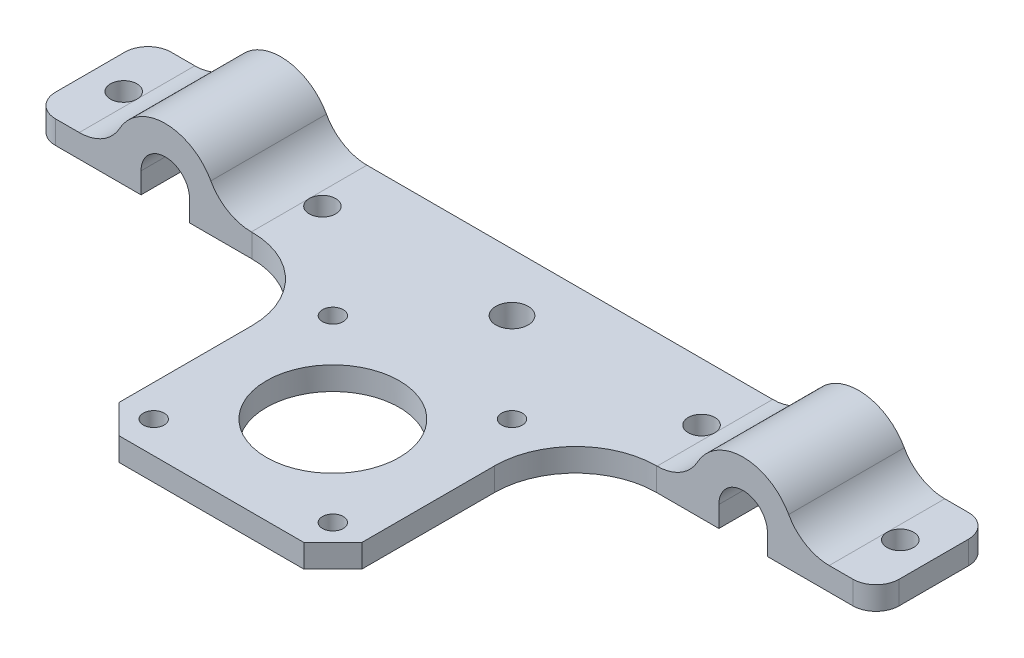
from build123d import *

# Parameters (mm, degrees)
EXTRUDE_1_DEPTH          = 20
FILLET_1_R               = 4
SKETCH_3_W               = 42
SKETCH_3_H               = 4
EXTRUDE_2_DEPTH          = 42
FILLET_2_R               = 14
CHAMFER_1_SIZE           = 5
CUT_EXTRUDE_1_DEPTH      = 97.177520869
CUT_EXTRUDE_1_DEPTH_BACK = 97.177520869
SKETCH_2_R               = 2.8
SKETCH_2_R_2             = 2.3
SKETCH_2_R_3             = 11.5
SKETCH_2_R_4             = 1.8


with BuildPart() as part:
    # 草图1 → 凸台-拉伸1 (new body)
    with BuildSketch(Plane.XY):
        with BuildLine():
            Line((54.2, 3.8), (54.2, 0.2))
            Line((54.2, 0.2), (72.997777503, 0.2))
            Line((72.997777503, 0.2), (72.997777503, 4.2))
            Line((72.997777503, 4.2), (64.891608375, 4.2))
            ThreePointArc((64.891608375, 4.2), (60.821632223, 5.312671482), (57.883792669, 8.341176471))
            ThreePointArc((57.883792669, 8.341176471), (50, 13), (42.116207331, 8.341176471))
            ThreePointArc((42.116207331, 8.341176471), (39.178367777, 5.312671482), (35.108391625, 4.2))
            Line((35.108391625, 4.2), (-35.108391625, 4.2))
            ThreePointArc((-35.108391625, 4.2), (-39.178367777, 5.312671482), (-42.116207331, 8.341176471))
            ThreePointArc((-42.116207331, 8.341176471), (-50, 13), (-57.883792669, 8.341176471))
            ThreePointArc((-57.883792669, 8.341176471), (-60.821632223, 5.312671482), (-64.891608375, 4.2))
            Line((-64.891608375, 4.2), (-72.997777503, 4.2))
            Line((-72.997777503, 4.2), (-72.997777503, 0.2))
            Line((-72.997777503, 0.2), (-54.2, 0.2))
            Line((-54.2, 0.2), (-54.2, 3.8))
            ThreePointArc((-54.2, 3.8), (-50, 8), (-45.8, 3.8))
            Line((-45.8, 3.8), (-45.8, 0.2))
            Line((-45.8, 0.2), (45.8, 0.2))
            Line((45.8, 0.2), (45.8, 3.8))
            ThreePointArc((45.8, 3.8), (50, 8), (54.2, 3.8))
        make_face()
    extrude(amount=EXTRUDE_1_DEPTH)

    # 圆角1
    fillet_1_edges = [part.edges().sort_by_distance(p)[0] for p in [
        (72.997777503, 2.2, 20),
        (-72.997777503, 2.2, 0),
        (72.997777503, 2.2, 0),
        (-72.997777503, 2.2, 20),
    ]]
    fillet(fillet_1_edges, radius=FILLET_1_R)

    # 草图3 → 凸台-拉伸2 (add)
    with BuildSketch(Plane.XY.offset(20)):
        with Locations((0, 2.2)):
            Rectangle(SKETCH_3_W, SKETCH_3_H)
    extrude(amount=EXTRUDE_2_DEPTH)

    # 圆角2
    fillet_2_edges = [part.edges().sort_by_distance(p)[0] for p in [
        (-21, 2.2, 20),
        (21, 2.2, 20),
    ]]
    fillet(fillet_2_edges, radius=FILLET_2_R)

    # 倒角1
    chamfer_1_edges = [part.edges().sort_by_distance(p)[0] for p in [
        (-21, 2.2, 62),
        (21, 2.2, 62),
    ]]
    chamfer(chamfer_1_edges, length=CHAMFER_1_SIZE)

    # 草图2 → 切除-拉伸1 (cut, two sides: drawn at the far end of the back side and taken through both)
    with BuildSketch(Plane(origin=(0, 4.2, 0), x_dir=(1, 0, 0), z_dir=(0, 1, 0)).offset(-CUT_EXTRUDE_1_DEPTH_BACK)):
        with Locations(Location((0, -10, 0), (0, 0, 270))):
            Circle(SKETCH_2_R)
        with Locations(Location((67.197777503, -10, 0), (0, 0, 270))):
            Circle(SKETCH_2_R_2)
        with Locations(Location((32.802222497, -10, 0), (0, 0, 90))):
            Circle(SKETCH_2_R_2)
        with Locations(Location((-32.802222497, -10, 0), (0, 0, 270))):
            Circle(SKETCH_2_R_2)
        with Locations((-67.197777503, -10)):
            Circle(SKETCH_2_R_2)
        with Locations(Location((0, -41, 0), (0, 0, 270))):
            Circle(SKETCH_2_R_3)
        with Locations(Location((15.5, -25.5, 0), (0, 0, 270))):
            Circle(SKETCH_2_R_4)
        with Locations(Location((15.5, -56.5, 0), (0, 0, 270))):
            Circle(SKETCH_2_R_4)
        with Locations(Location((-15.5, -56.5, 0), (0, 0, 270))):
            Circle(SKETCH_2_R_4)
        with Locations(Location((-15.5, -25.5, 0), (0, 0, 270))):
            Circle(SKETCH_2_R_4)
    extrude(amount=CUT_EXTRUDE_1_DEPTH + CUT_EXTRUDE_1_DEPTH_BACK, mode=Mode.SUBTRACT)


solid = part.part
